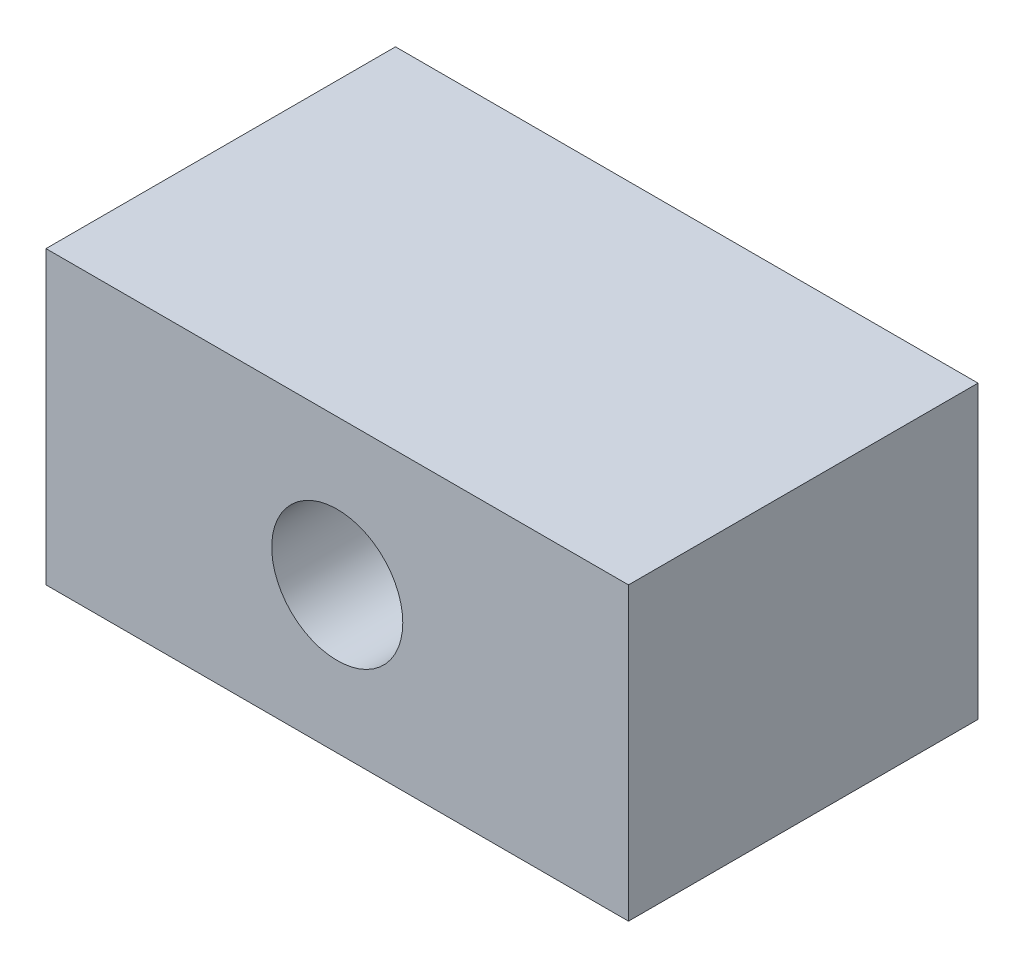
from build123d import *

# Parameters (mm, degrees)
BASESKETCH_W        = 200
BASESKETCH_H        = 120
BOSS_EXTRUDE1_DEPTH = 100
SKETCH2_R           = 22.5
CUT_EXTRUDE1_DEPTH  = 186.47236991


with BuildPart() as part:
    # BaseSketch → Boss-Extrude1 (new body)
    with BuildSketch(Plane(origin=(0, 0, 0), x_dir=(1, 0, 0), z_dir=(0, 1, 0))):
        Rectangle(BASESKETCH_W, BASESKETCH_H)
    extrude(amount=BOSS_EXTRUDE1_DEPTH)

    # Sketch2 → Cut-Extrude1 (cut, through all)
    with BuildSketch(Plane.XY.offset(60)):
        with Locations((0, 50)):
            Circle(SKETCH2_R)
    extrude(amount=-CUT_EXTRUDE1_DEPTH, mode=Mode.SUBTRACT)


solid = part.part
